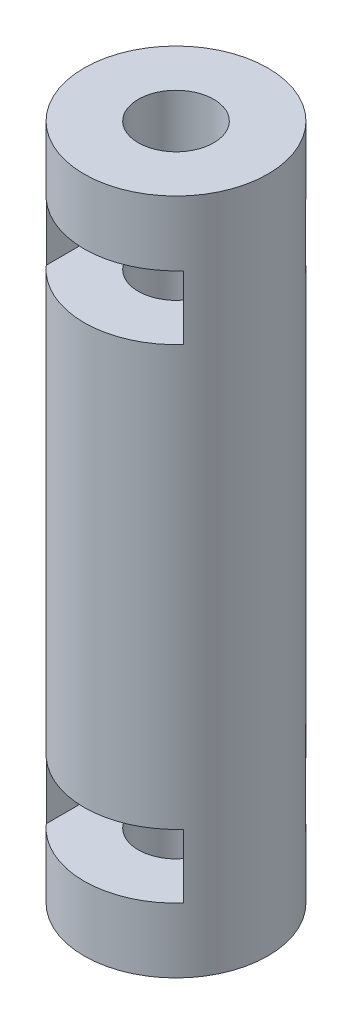
from build123d import *

# Parameters (mm, degrees)
SKETCH1_R               = 4.75
SKETCH1_R_2             = 1.95
BOSS_EXTRUDE1_DEPTH     = 35
CUT_EXTRUDE1_DEPTH      = 36.638813112
CUT_EXTRUDE1_DEPTH_BACK = 36.638813112
SKETCH2_W               = 7.1
SKETCH2_H               = 3.3


with BuildPart() as part:
    # Sketch1 → Boss-Extrude1 (new body)
    with BuildSketch(Plane(origin=(0, 0, 0), x_dir=(1, 0, 0), z_dir=(0, 1, 0))):
        with Locations(Location((0, 0, 0), (0, 0, 270))):
            Circle(SKETCH1_R)
        with Locations(Location((0, 0, 0), (0, 0, 270))):
            Circle(SKETCH1_R_2, mode=Mode.SUBTRACT)
    extrude(amount=BOSS_EXTRUDE1_DEPTH)

    # Sketch2 → Cut-Extrude1 (cut, two sides: drawn at the far end of the back side and taken through both)
    with BuildSketch(Plane.XY.offset(-CUT_EXTRUDE1_DEPTH_BACK)):
        with Locations((0, 30)):
            Rectangle(SKETCH2_W, SKETCH2_H)
        with Locations((0, 5)):
            Rectangle(SKETCH2_W, SKETCH2_H)
    extrude(amount=CUT_EXTRUDE1_DEPTH + CUT_EXTRUDE1_DEPTH_BACK, mode=Mode.SUBTRACT)


solid = part.part
